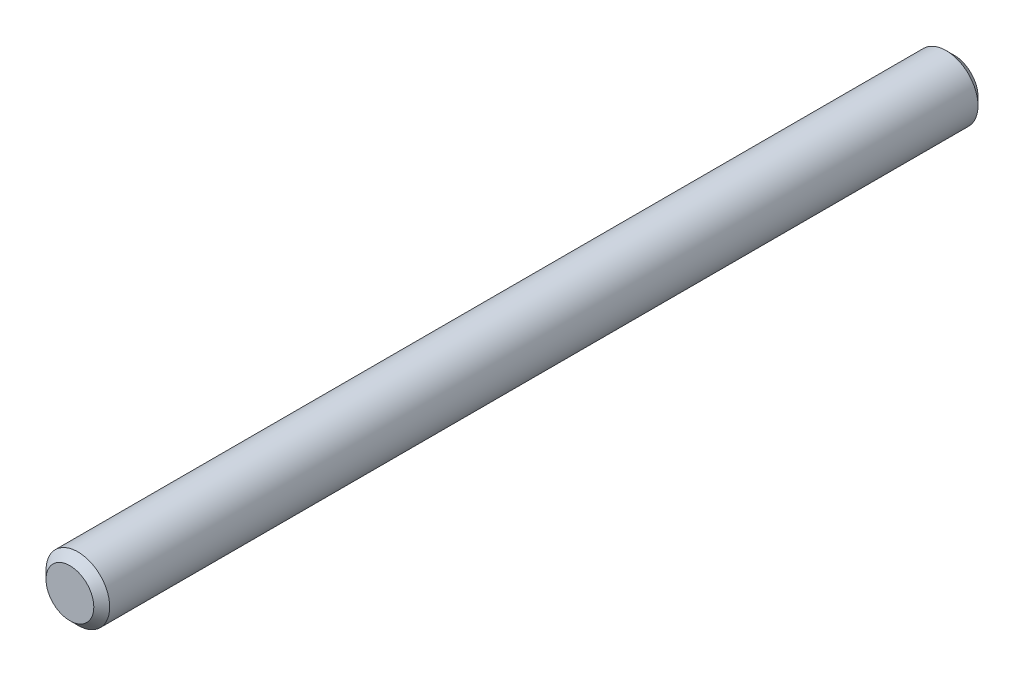
from build123d import *

# Parameters (mm, degrees)
SKETCH1_R          = 4
BOSS_EXTRU_1_DEPTH = 111
CHANFREIN1_SIZE    = 1


with BuildPart() as part:
    # Sketch1 → Boss.-Extru.1 (new body)
    with BuildSketch(Plane.XY):
        Circle(SKETCH1_R)
    extrude(amount=BOSS_EXTRU_1_DEPTH)

    # Chanfrein1
    chanfrein1_edges = [part.edges().sort_by_distance(p)[0] for p in [
        (-4, 0, 0),
        (-4, 0, 111),
    ]]
    chamfer(chanfrein1_edges, length=CHANFREIN1_SIZE)


solid = part.part
